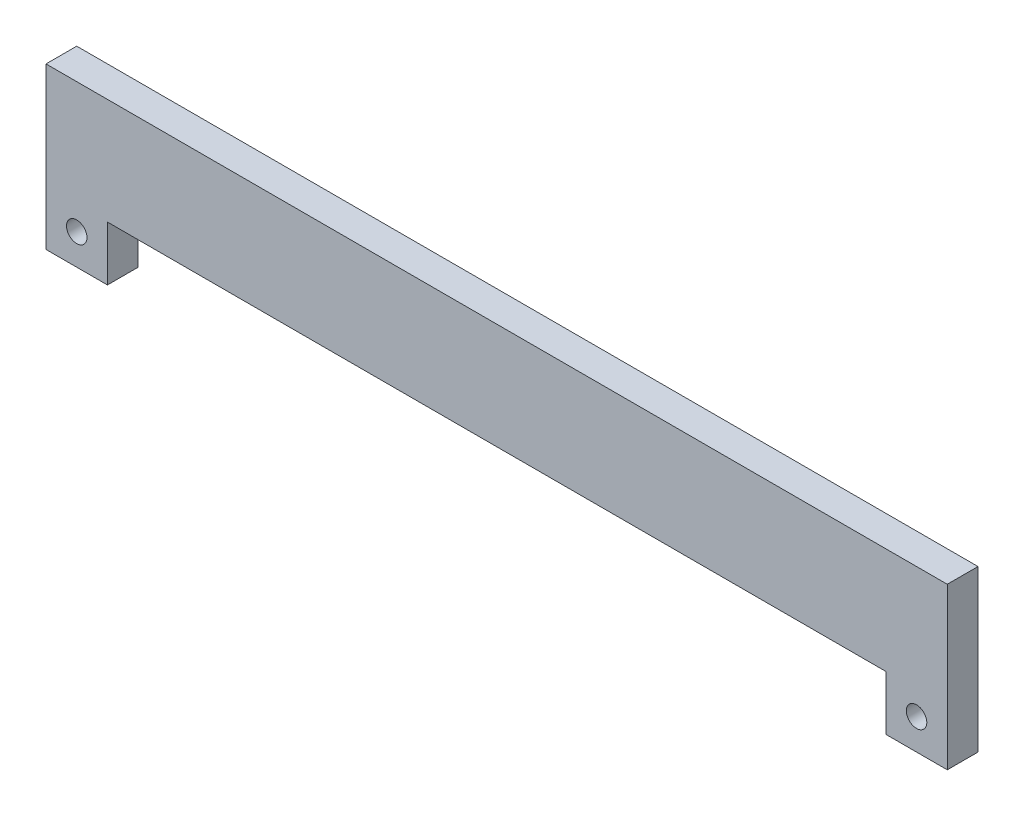
from build123d import *

# Parameters (mm, degrees)
SKETCH1_R           = 6.35
BOSS_EXTRUDE1_DEPTH = 19.05


with BuildPart() as part:
    # Sketch1 → Boss-Extrude1 (new body)
    with BuildSketch(Plane.XY):
        Polygon((-241.3, -25.755), (-241.3, -59.55), (-279.4, -59.55), (-279.4, 40.1), (279.4, 40.1), (279.4, -59.55), (241.3, -59.55), (241.3, -25.755), align=None)
        with Locations(Location((260.35, -40.5, 0), (0, 0, 180))):
            Circle(SKETCH1_R, mode=Mode.SUBTRACT)
        with Locations(Location((-260.35, -40.5, 0), (0, 0, 180))):
            Circle(SKETCH1_R, mode=Mode.SUBTRACT)
    extrude(amount=BOSS_EXTRUDE1_DEPTH)


solid = part.part
